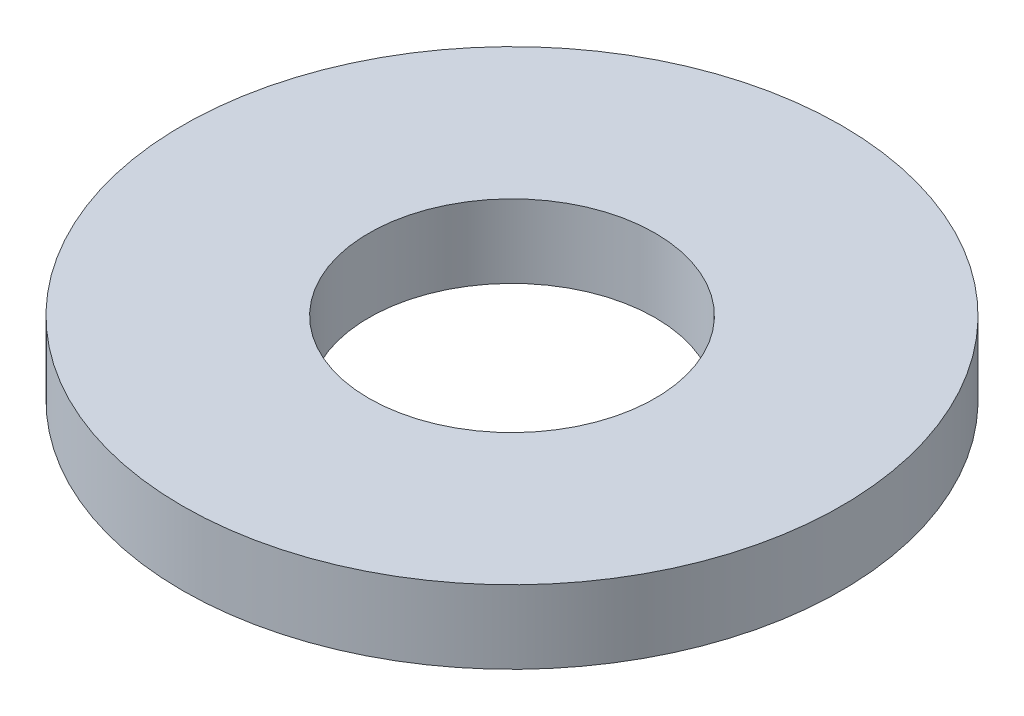
from build123d import *

# Parameters (mm, degrees)
SKETCH1_R           = 24.75
BOSS_EXTRUDE1_DEPTH = 5.5
CUT_EXTRUDE1_REACH  = 37.431
SKETCH2_R           = 10.75


with BuildPart() as part:
    # Sketch1 → Boss-Extrude1 (new body)
    with BuildSketch(Plane(origin=(0, 0, 0), x_dir=(1, 0, 0), z_dir=(0, 1, 0))):
        with Locations(Location((0, 0, 0), (0, 0, 270))):
            Circle(SKETCH1_R)
    extrude(amount=BOSS_EXTRUDE1_DEPTH)

    # Sketch2 → Cut-Extrude1 (cut, up to next)
    with BuildSketch(Plane(origin=(0, 5.5, 0), x_dir=(1, 0, 0), z_dir=(0, 1, 0)), mode=Mode.PRIVATE) as cut_extrude1_sk1:
        with Locations(Location((0, 0, 0), (0, 0, 270))):
            Circle(SKETCH2_R)
    cut_extrude1_tool1 = extrude(cut_extrude1_sk1.sketch, amount=-CUT_EXTRUDE1_REACH, mode=Mode.PRIVATE) & part.part
    add(cut_extrude1_tool1.solids().sort_by_distance((0, 5.5, 0))[0], mode=Mode.SUBTRACT)


solid = part.part
